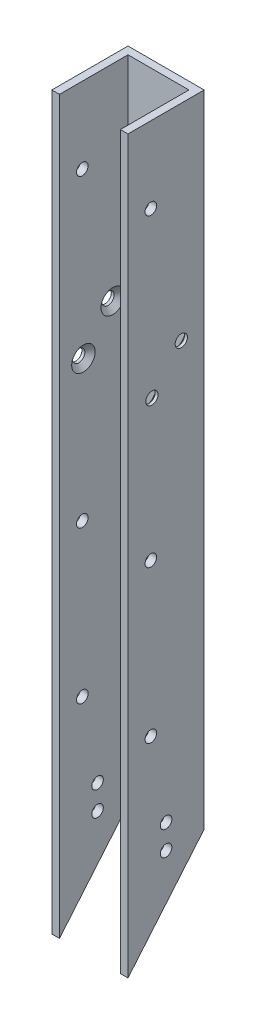
from build123d import *

# Parameters (mm, degrees)
BOSS_EXTRUDE1_DEPTH                        = 304.8
CUT_EXTRUDE1_DEPTH                         = 307.860095361
CUT_EXTRUDE2_DEPTH                         = 307.860095361
CUT_EXTRUDE2_DEPTH_BACK                    = 307.860095361
SKETCH3_R                                  = 2.413
CUT_EXTRUDE3_DEPTH                         = 307.860095361
CUT_EXTRUDE3_DEPTH_BACK                    = 307.860095361
SKETCH4_R                                  = 2.413
CSK_FOR_10_FLAT_HEAD_MACHINE_SCREW_2_COUNT = 2
CSK_FOR_10_FLAT_HEAD_MACHINE_SCREW_2_PITCH = 19.05


with BuildPart() as part:
    # Sketch1 → Boss-Extrude1 (new body)
    with BuildSketch(Plane(origin=(0, 0, 0), x_dir=(1, 0, 0), z_dir=(0, 1, 0))):
        Polygon((-15.875, -15.875), (-12.7, -15.875), (-12.7, 12.7), (12.7, 12.7), (12.7, -15.875), (15.875, -15.875), (15.875, 15.875), (-15.875, 15.875), align=None)
    extrude(amount=BOSS_EXTRUDE1_DEPTH)

    # Sketch2 → Cut-Extrude1 (cut, through all)
    with BuildSketch(Plane(origin=(15.875, 0, 0), x_dir=(0, 0, -1), z_dir=(1, 0, 0))):
        Polygon((-15.875, 0), (15.875, 37.838176565), (15.875, 0), align=None)
    extrude(amount=-CUT_EXTRUDE1_DEPTH, mode=Mode.SUBTRACT)

    # Sketch3 → Cut-Extrude2 (cut, two sides: drawn at the far end of the back side and taken through both)
    with BuildSketch(Plane(origin=(15.875, 0, 0), x_dir=(0, 0, -1), z_dir=(1, 0, 0)).offset(-CUT_EXTRUDE2_DEPTH_BACK)):
        with Locations((-6.35, 273.05)):
            Circle(SKETCH3_R)
        with Locations((-6.35, 82.55)):
            Circle(SKETCH3_R)
        with Locations((-6.35, 146.05)):
            Circle(SKETCH3_R)
    extrude(amount=CUT_EXTRUDE2_DEPTH + CUT_EXTRUDE2_DEPTH_BACK, mode=Mode.SUBTRACT)

    # Sketch4 → Cut-Extrude3 (cut, two sides: drawn at the far end of the back side and taken through both)
    with BuildSketch(Plane(origin=(15.875, 0, 0), x_dir=(0, 0, -1), z_dir=(1, 0, 0)).offset(-CUT_EXTRUDE3_DEPTH_BACK)):
        with Locations((0, 48.274473485)):
            Circle(SKETCH4_R)
        with Locations((0, 38.114473485)):
            Circle(SKETCH4_R)
    extrude(amount=CUT_EXTRUDE3_DEPTH + CUT_EXTRUDE3_DEPTH_BACK, mode=Mode.SUBTRACT)

    # Sketch11 → CSK for #10 Flat Head Machine Screw (100)1 (revolve, cut)
    with BuildSketch(Plane(origin=(12.7, 219.033346522, -6.35), x_dir=(0, 0, 1), z_dir=(0, 1, 0))):
        Polygon((0, 0), (0, 3.175), (2.5527, 3.175), (2.5527, 1.960808018), (4.8895, 0), align=None)
    csk_for_10_flat_head_machine_screw_100 = revolve(axis=Axis((6.35, 219.033346522, -6.35), (1, 0, 0)), mode=Mode.SUBTRACT)

    # CSK for _10 Flat Head Machine Screw  2: CSK for #10 Flat Head Machine Screw (100)1 ×2
    with Locations(*[Vector(0, -0.766044443118978, 0.6427876096865395) * (i * CSK_FOR_10_FLAT_HEAD_MACHINE_SCREW_2_PITCH) for i in range(1, CSK_FOR_10_FLAT_HEAD_MACHINE_SCREW_2_COUNT)]):
        add(csk_for_10_flat_head_machine_screw_100, mode=Mode.SUBTRACT)

    # Mirror4: CSK for #10 Flat Head Machine Screw (100)1 across plane
    add(csk_for_10_flat_head_machine_screw_100.mirror(Plane(origin=(0, 0, 0), x_dir=(0, 0, 1), z_dir=(1, 0, 0))), mode=Mode.SUBTRACT)

    # Mirror4 copy 1 sketch → Mirror4 copy 1 (revolve, cut)
    with BuildSketch(Plane(origin=(-12.7, 204.440199881, 5.895103965), x_dir=(0, 0, 1), z_dir=(0, 1, 0))):
        Polygon((0, 0), (0, -3.175), (2.5527, -3.175), (2.5527, -1.960808018), (4.8895, 0), align=None)
    revolve(axis=Axis((-6.35, 204.440199881, 5.895103965), (1, 0, 0)), mode=Mode.SUBTRACT)


solid = part.part
